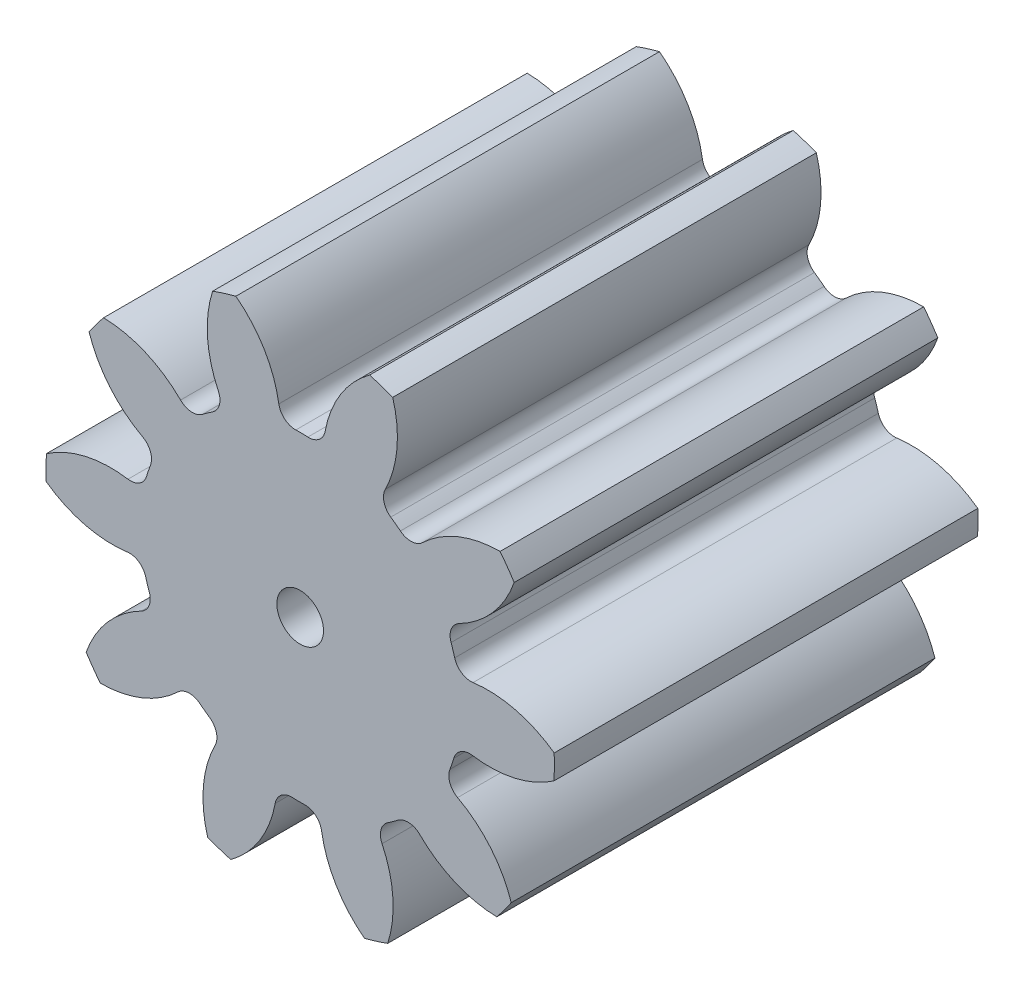
from build123d import *

# Parameters (mm, degrees)
SKETCH3_R         = 15.24
GEARBODY_DEPTH    = 25.4
TOOTHCUT_DEPTH    = 34.311787703
CIRPATTERN1_COUNT = 10
BOREDIA_R         = 1.396999992
BORE_DEPTH        = 12700


with BuildPart() as part:
    # Sketch3 → gearBody (new body)
    with BuildSketch(Plane.XY):
        Circle(SKETCH3_R)
    extrude(amount=GEARBODY_DEPTH)

    # Sketch2 → toothCut (cut, through all)
    with BuildSketch(Plane.XY):
        with BuildLine():
            ThreePointArc((8.978148959, -3.402334891), (9.099733091, -3.062335565), (9.208446704, -2.718004919))
            ThreePointArc((9.208446704, -2.718004919), (9.633677899, -2.154183003), (10.324904213, -2.009535477))
            ThreePointArc((10.324904213, -2.009535477), (14.577189645, -1.27852495), (17.531773304, 1.865794244))
            ThreePointArc((17.531773304, 1.865794244), (16.709927513, -5.623396291), (12.836674632, -12.085695996))
            ThreePointArc((12.836674632, -12.085695996), (12.384259618, -7.794818645), (9.439116174, -4.64165549))
            ThreePointArc((9.439116174, -4.64165549), (8.975980875, -4.108530348), (8.978148959, -3.402334891))
        make_face()
    toothcut = extrude(amount=TOOTHCUT_DEPTH, mode=Mode.SUBTRACT)

    # CirPattern1: toothCut ×10 about axis
    cirpattern1_axis = Axis((0, 0, 25.4), (0, 0, -1))
    for i in range(1, CIRPATTERN1_COUNT):
        add(toothcut.rotate(cirpattern1_axis, i * 360 / CIRPATTERN1_COUNT), mode=Mode.SUBTRACT)

    # boreDia → bore (cut, symmetric)
    with BuildSketch(Plane.XY):
        Circle(BOREDIA_R)
    extrude(amount=BORE_DEPTH, both=True, mode=Mode.SUBTRACT)


solid = part.part
